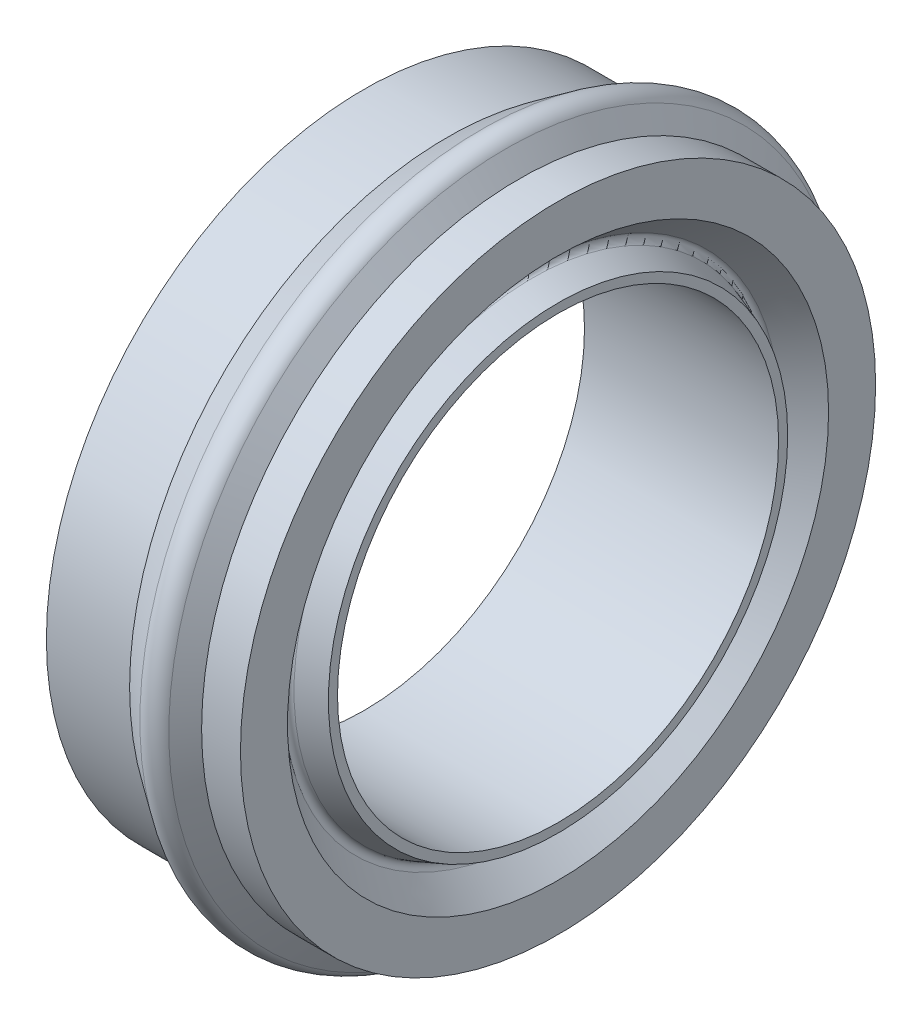
from build123d import *


with BuildPart() as part:
    # Croquis1 → Revolución1 (revolve)
    with BuildSketch(Plane.XY, mode=Mode.PRIVATE) as revoluci_n1_sk:
        with BuildLine():
            Line((23.843190864, 18), (21.641499939, 18))
            Line((21.641499939, 18), (20.877394398, 19.095222917))
            ThreePointArc((20.877394398, 19.095222917), (20.232592167, 19.507553513), (19.485086377, 19.343171243))
            Line((19.485086377, 19.343171243), (17.559865516, 18))
            Line((17.559865516, 18), (12.843190864, 18))
            Line((12.843190864, 18), (12.843190864, 16.782184677))
            Line((12.843190864, 16.782184677), (15.239734897, 14.672192861))
            ThreePointArc((15.239734897, 14.672192861), (15.397557992, 14.189058917), (15.050891885, 13.817374713))
            Line((15.050891885, 13.817374713), (12.843190864, 13.165654901))
            Line((12.843190864, 13.165654901), (12.843190864, 12.5))
            Line((12.843190864, 12.5), (23.843190864, 12.5))
            Line((23.843190864, 12.5), (23.843190864, 13.017083416))
            Line((23.843190864, 13.017083416), (22.414504066, 13.535357634))
            ThreePointArc((22.414504066, 13.535357634), (22.221515959, 13.764442451), (22.32291652, 14.046297359))
            Line((22.32291652, 14.046297359), (23.843190864, 15.333938712))
            Line((23.843190864, 15.333938712), (23.843190864, 18))
        make_face()
    revolve(revoluci_n1_sk.sketch.rotate(Axis((29.11578235, 0, 0), (-1, 0, 0)), 90), axis=Axis((29.11578235, 0, 0), (-1, 0, 0)))


solid = part.part
